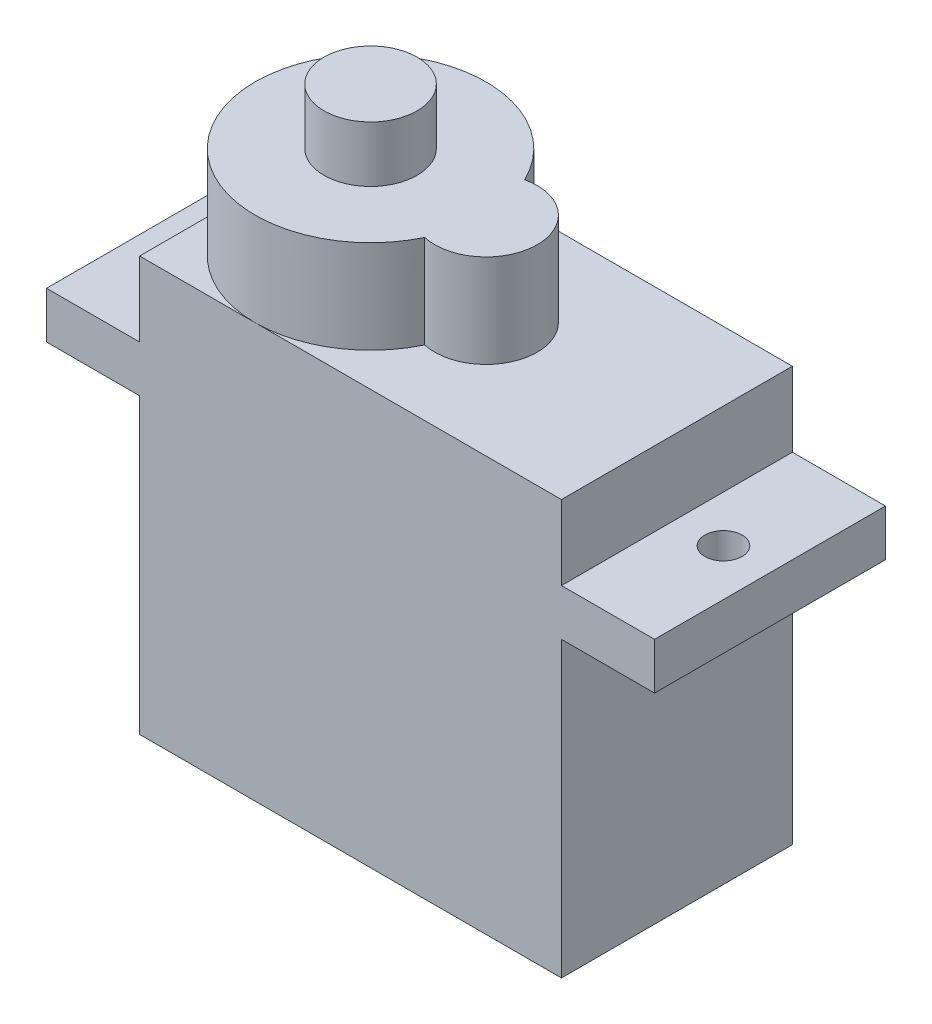
from build123d import *

# Parameters (mm, degrees)
SALIENTE_EXTRUIR1_DEPTH = 12.4
SALIENTE_EXTRUIR2_DEPTH = 5
CROQUIS3_R              = 2.5
SALIENTE_EXTRUIR3_DEPTH = 3
CROQUIS4_W              = 4
CROQUIS4_H              = 1
SALIENTE_EXTRUIR4_DEPTH = 3
CROQUIS5_R              = 1
CORTAR_EXTRUIR1_DEPTH   = 2.5


with BuildPart() as part:
    # Croquis1 → Saliente-Extruir1 (new body)
    with BuildSketch(Plane.XY):
        Polygon((-22.65, 18.25), (-22.65, 22.25), (0, 22.25), (0, 18.25), (5, 18.25), (5, 15.75), (0, 15.75), (0, 0), (-22.65, 0), (-22.65, 15.75), (-27.65, 15.75), (-27.65, 18.25), align=None)
    extrude(amount=SALIENTE_EXTRUIR1_DEPTH)

    # Croquis2 → Saliente-Extruir2 (add)
    with BuildSketch(Plane(origin=(0, 22.25, 0), x_dir=(1, 0, 0), z_dir=(0, 1, 0))):
        with BuildLine():
            ThreePointArc((-10.859879032, -3.518480363), (-22.65, -6.2), (-10.859879032, -8.881519637))
            ThreePointArc((-10.859879032, -8.881519637), (-7.5, -6.2), (-10.859879032, -3.518480363))
        make_face()
    extrude(amount=SALIENTE_EXTRUIR2_DEPTH)

    # Croquis3 → Saliente-Extruir3 (add)
    with BuildSketch(Plane(origin=(0, 27.25, 0), x_dir=(1, 0, 0), z_dir=(0, 1, 0))):
        with Locations(Location((-16.45, -6.2, 0), (0, 0, 180))):
            Circle(CROQUIS3_R)
    extrude(amount=SALIENTE_EXTRUIR3_DEPTH)

    # Croquis4 → Saliente-Extruir4 (add)
    with BuildSketch(Plane.ZY.offset(22.65)):
        with Locations((6.2, 5)):
            Rectangle(CROQUIS4_W, CROQUIS4_H)
    extrude(amount=SALIENTE_EXTRUIR4_DEPTH)

    # Croquis5 → Cortar-Extruir1 (cut)
    with BuildSketch(Plane(origin=(0, 18.25, 0), x_dir=(1, 0, 0), z_dir=(0, 1, 0))):
        with Locations(Location((2.5, -6.2, 0), (0, 0, 270))):
            Circle(CROQUIS5_R)
        with Locations(Location((-25.15, -6.2, 0), (0, 0, 270))):
            Circle(CROQUIS5_R)
    extrude(amount=-CORTAR_EXTRUIR1_DEPTH, mode=Mode.SUBTRACT)


solid = part.part
